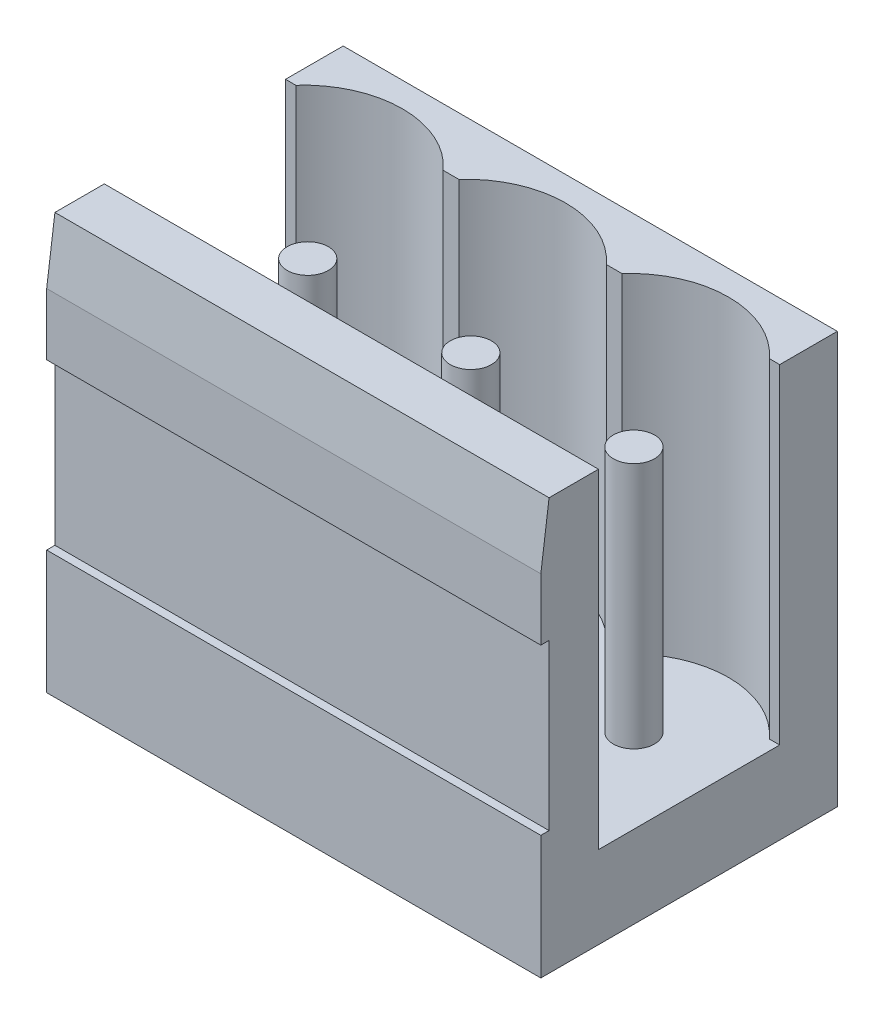
from build123d import *

# Parameters (mm, degrees)
SKETCH_1_W             = 12
SKETCH_1_H             = 10
EXTRUDE_1_DEPTH        = 7.2
SKETCH_2_W             = 1.17709233
SKETCH_2_H             = 4
CUT_EXTRUDE_1_DEPTH    = 18.2
CUT_EXTRUDE_2_DEPTH    = 18.2
SKETCH_4_W             = 1
SKETCH_4_H             = 4.2
CUT_EXTRUDE_3_DEPTH    = 1
PATTERN_LINEAR_1_COUNT = 2
PATTERN_LINEAR_1_PITCH = 3.96
PATTERN_LINEAR_2_COUNT = 2
PATTERN_LINEAR_2_PITCH = 3.96
SKETCH_5_R             = 0.4
EXTRUDE_3_DEPTH        = 5.8
PATTERN_LINEAR_3_COUNT = 3
PATTERN_LINEAR_3_PITCH = 3.96
CUT_EXTRUDE_4_DEPTH    = 8
SKETCH_7_R             = 0.5
EXTRUDE_4_DEPTH        = 6


with BuildPart() as part:
    # 草图1 → 凸台-拉伸1 (new body)
    with BuildSketch(Plane.XY):
        with Locations((6, 5)):
            Rectangle(SKETCH_1_W, SKETCH_1_H)
    extrude(amount=EXTRUDE_1_DEPTH)

    # 草图2 → 切除-拉伸1 (cut, through all)
    with BuildSketch(Plane(origin=(12, 0, 0), x_dir=(0, 0, -1), z_dir=(1, 0, 0))):
        with Locations((-7.588546165, 5)):
            Rectangle(SKETCH_2_W, SKETCH_2_H)
    extrude(amount=-CUT_EXTRUDE_1_DEPTH, mode=Mode.SUBTRACT)

    # 草图3 → 切除-拉伸2 (cut, through all)
    with BuildSketch(Plane(origin=(12, 0, 0), x_dir=(0, 0, -1), z_dir=(1, 0, 0))):
        Polygon((-7, 10), (-7.2, 8.5), (-7.2, 10), align=None)
    extrude(amount=-CUT_EXTRUDE_2_DEPTH, mode=Mode.SUBTRACT)

    # 草图4 → 切除-拉伸3 (cut)
    with BuildSketch(Plane.XZ):
        with Locations((6, 2.1)):
            Rectangle(SKETCH_4_W, SKETCH_4_H)
    cut_extrude_3 = extrude(amount=-CUT_EXTRUDE_3_DEPTH, mode=Mode.SUBTRACT)

    # 阵列(线性)1: 切除-拉伸3 ×2
    with Locations(*[(i * PATTERN_LINEAR_1_PITCH, 0, 0) for i in range(1, PATTERN_LINEAR_1_COUNT)]):
        add(cut_extrude_3, mode=Mode.SUBTRACT)

    # 阵列(线性)2: 切除-拉伸3 ×2
    with Locations(*[(-i * PATTERN_LINEAR_2_PITCH, 0, 0) for i in range(1, PATTERN_LINEAR_2_COUNT)]):
        add(cut_extrude_3, mode=Mode.SUBTRACT)

    # 草图5 → 凸台-拉伸3 (add)
    with BuildSketch(Plane(origin=(0, 0, 4.2), x_dir=(-1, 0, 0), z_dir=(0, 0, -1))):
        with Locations(Location((-2.04, 0.5, 0), (0, 0, 180))):
            Circle(SKETCH_5_R)
    extrude_3 = extrude(amount=EXTRUDE_3_DEPTH)

    # 阵列(线性)3: 凸台-拉伸3 ×3
    with Locations(*[(i * PATTERN_LINEAR_3_PITCH, 0, 0) for i in range(1, PATTERN_LINEAR_3_COUNT)]):
        add(extrude_3)

    # 草图6 → 切除-拉伸4 (cut)
    with BuildSketch(Plane(origin=(0, 10, 0), x_dir=(1, 0, 0), z_dir=(0, 1, 0))):
        with BuildLine():
            Line((0, -5.8), (12, -5.8))
            Line((12, -5.8), (12, -4.26427845))
            Line((12, -4.26427845), (12, -1.4))
            Line((12, -1.4), (11.748854382, -1.4))
            ThreePointArc((11.748854382, -1.4), (9.96, -0.6), (8.171145618, -1.4))
            Line((8.171145618, -1.4), (7.788854382, -1.4))
            ThreePointArc((7.788854382, -1.4), (6, -0.6), (4.211145618, -1.4))
            Line((4.211145618, -1.4), (3.828854382, -1.4))
            ThreePointArc((3.828854382, -1.4), (2.04, -0.6), (0.251145618, -1.4))
            Line((0.251145618, -1.4), (0, -1.4))
            Line((0, -1.4), (0, -5.8))
        make_face()
    extrude(amount=-CUT_EXTRUDE_4_DEPTH, mode=Mode.SUBTRACT)

    # 草图7 → 凸台-拉伸4 (add)
    with BuildSketch(Plane(origin=(0, 2, 0), x_dir=(-1, 0, 0), z_dir=(0, 1, 0))):
        with Locations(Location((-6, 2.9, 0), (0, 0, 90))):
            Circle(SKETCH_7_R)
        with Locations(Location((-9.96, 2.9, 0), (0, 0, 90))):
            Circle(SKETCH_7_R)
        with Locations(Location((-2.04, 2.9, 0), (0, 0, 90))):
            Circle(SKETCH_7_R)
    extrude(amount=EXTRUDE_4_DEPTH)


solid = part.part
